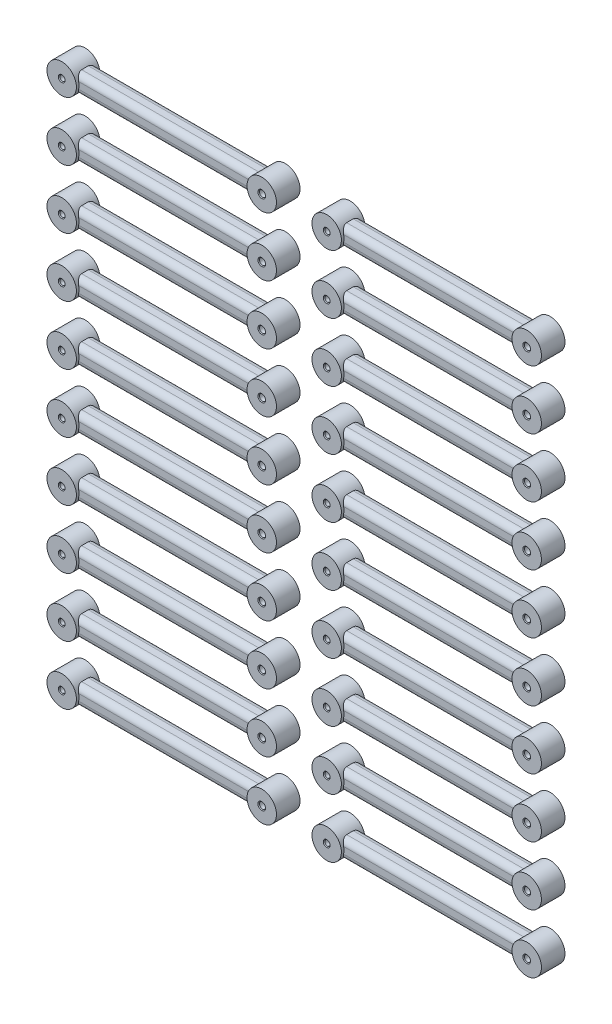
from build123d import *

# Parameters (mm, degrees)
SKETCH_1_R                       = 2
SKETCH_1_R_2                     = 0.36
EXTRUDE_1_DEPTH                  = 1.6
SKETCH_1_R_3                     = 0.42
EXTRUDE_1_2_DEPTH                = 1.6
EXTRUDE_2_REACH                  = 28.306
EXTRUDE_2_END_RADIUS             = 2
SKETCH_2_W                       = 2.5
SKETCH_2_H                       = 2.5
EXTRUDE_2_DIRECTION_2_REACH      = 28.306
EXTRUDE_2_DIRECTION_2_END_RADIUS = 2
CHAMFER_1_SIZE                   = 0.1
FILLET_1_R                       = 0.8
PATTERN_LINEAR_1_COUNT           = 10
PATTERN_LINEAR_1_PITCH           = 8
PATTERN_LINEAR_1_2_COUNT         = 2
PATTERN_LINEAR_1_2_PITCH         = 36


with BuildPart() as part:
    # 草图1 → 凸台-拉伸1 (new, symmetric)
    with BuildSketch(Plane.XY):
        Circle(SKETCH_1_R)
        Circle(SKETCH_1_R_2, mode=Mode.SUBTRACT)
    extrude(amount=EXTRUDE_1_DEPTH, both=True)



with BuildPart() as body_2:
    # 草图1 → Extrude 1 2 (new, symmetric)
    with BuildSketch(Plane.XY):
        with Locations((27.180718048, 0)):
            Circle(SKETCH_1_R)
        with Locations((27.180718048, 0)):
            Circle(SKETCH_1_R_3, mode=Mode.SUBTRACT)
    extrude(amount=EXTRUDE_1_2_DEPTH, both=True)


with BuildPart() as part_1:
    add(part.part)

    add(body_2.part)  # 凸台-拉伸2 merges body 2
    # 凸台-拉伸2: up to this cylinder (the profile starts outside it)
    extrude_2_end = Plane(origin=(27.180718048, 0, 0), z_dir=(0, 0, -1)) * Cylinder(EXTRUDE_2_END_RADIUS, 61.612, mode=Mode.PRIVATE)
    # 草图2 → 凸台-拉伸2 (add, up to the surface)
    with BuildSketch(Plane(origin=(3, 0, 0), x_dir=(0, 0, -1), z_dir=(1, 0, 0)), mode=Mode.PRIVATE) as extrude_2_sk1:
        Rectangle(SKETCH_2_W, SKETCH_2_H)
    extrude_2_tool1 = extrude(extrude_2_sk1.sketch, amount=EXTRUDE_2_REACH, mode=Mode.PRIVATE) - extrude_2_end
    add(extrude_2_tool1.solids().sort_by_distance((3, 0, 0))[0])

    # 凸台-拉伸2 direction 2: up to this cylinder (the profile starts outside it)
    extrude_2_direction_2_end = Plane(origin=(0, 0, 0), z_dir=(0, 0, -1)) * Cylinder(EXTRUDE_2_DIRECTION_2_END_RADIUS, 61.612, mode=Mode.PRIVATE)
    # 草图2 → 凸台-拉伸2 direction 2 (add, up to the surface)
    with BuildSketch(Plane(origin=(3, 0, 0), x_dir=(0, 0, -1), z_dir=(1, 0, 0)), mode=Mode.PRIVATE) as extrude_2_direction_2_sk1:
        Rectangle(SKETCH_2_W, SKETCH_2_H)
    extrude_2_direction_2_tool1 = extrude(extrude_2_direction_2_sk1.sketch, amount=-EXTRUDE_2_DIRECTION_2_REACH, mode=Mode.PRIVATE) - extrude_2_direction_2_end
    add(extrude_2_direction_2_tool1.solids().sort_by_distance((3, 0, 0))[0])

    # 倒角1
    chamfer_1_edges = [part_1.edges().sort_by_distance(p)[0] for p in [
        (26.760718048, 0, 1.6),
        (26.760718048, 0, -1.6),
        (-0.36, 0, 1.6),
        (-0.36, 0, -1.6),
    ]]
    chamfer(chamfer_1_edges, length=CHAMFER_1_SIZE)

    # 圆角1
    fillet_1_edges = [part_1.edges().sort_by_distance(p)[0] for p in [
        (13.590359024, -1.25, 1.25),
        (13.590359024, -1.25, -1.25),
        (13.590359024, 1.25, 1.25),
        (13.590359024, 1.25, -1.25),
    ]]
    fillet(fillet_1_edges, radius=FILLET_1_R)


with BuildPart() as pattern_linear_1_1:
    # 阵列(线性)1: pattern copy
    add(part_1.part.moved(Location(Vector(0, 1, 0) * (1 * PATTERN_LINEAR_1_PITCH))))


with BuildPart() as pattern_linear_1_2:
    # 阵列(线性)1: pattern copy
    add(part_1.part.moved(Location(Vector(0, 1, 0) * (2 * PATTERN_LINEAR_1_PITCH))))


with BuildPart() as pattern_linear_1_3:
    # 阵列(线性)1: pattern copy
    add(part_1.part.moved(Location(Vector(0, 1, 0) * (3 * PATTERN_LINEAR_1_PITCH))))


with BuildPart() as pattern_linear_1_4:
    # 阵列(线性)1: pattern copy
    add(part_1.part.moved(Location(Vector(0, 1, 0) * (4 * PATTERN_LINEAR_1_PITCH))))


with BuildPart() as pattern_linear_1_5:
    # 阵列(线性)1: pattern copy
    add(part_1.part.moved(Location(Vector(0, 1, 0) * (5 * PATTERN_LINEAR_1_PITCH))))


with BuildPart() as pattern_linear_1_6:
    # 阵列(线性)1: pattern copy
    add(part_1.part.moved(Location(Vector(0, 1, 0) * (6 * PATTERN_LINEAR_1_PITCH))))


with BuildPart() as pattern_linear_1_7:
    # 阵列(线性)1: pattern copy
    add(part_1.part.moved(Location(Vector(0, 1, 0) * (7 * PATTERN_LINEAR_1_PITCH))))


with BuildPart() as pattern_linear_1_8:
    # 阵列(线性)1: pattern copy
    add(part_1.part.moved(Location(Vector(0, 1, 0) * (8 * PATTERN_LINEAR_1_PITCH))))


with BuildPart() as pattern_linear_1_9:
    # 阵列(线性)1: pattern copy
    add(part_1.part.moved(Location(Vector(0, 1, 0) * (9 * PATTERN_LINEAR_1_PITCH))))


with BuildPart() as pattern_linear_1_2_1:
    # Pattern Linear 1 2: pattern copy
    add(part_1.part.moved(Location(Vector(1, 0, 0) * (1 * PATTERN_LINEAR_1_2_PITCH))))


with BuildPart() as pattern_linear_1_2_2:
    # Pattern Linear 1 2: pattern copy
    add(pattern_linear_1_1.part.moved(Location(Vector(1, 0, 0) * (1 * PATTERN_LINEAR_1_2_PITCH))))


with BuildPart() as pattern_linear_1_2_3:
    # Pattern Linear 1 2: pattern copy
    add(pattern_linear_1_2.part.moved(Location(Vector(1, 0, 0) * (1 * PATTERN_LINEAR_1_2_PITCH))))


with BuildPart() as pattern_linear_1_2_4:
    # Pattern Linear 1 2: pattern copy
    add(pattern_linear_1_3.part.moved(Location(Vector(1, 0, 0) * (1 * PATTERN_LINEAR_1_2_PITCH))))


with BuildPart() as pattern_linear_1_2_5:
    # Pattern Linear 1 2: pattern copy
    add(pattern_linear_1_4.part.moved(Location(Vector(1, 0, 0) * (1 * PATTERN_LINEAR_1_2_PITCH))))


with BuildPart() as pattern_linear_1_2_6:
    # Pattern Linear 1 2: pattern copy
    add(pattern_linear_1_5.part.moved(Location(Vector(1, 0, 0) * (1 * PATTERN_LINEAR_1_2_PITCH))))


with BuildPart() as pattern_linear_1_2_7:
    # Pattern Linear 1 2: pattern copy
    add(pattern_linear_1_6.part.moved(Location(Vector(1, 0, 0) * (1 * PATTERN_LINEAR_1_2_PITCH))))


with BuildPart() as pattern_linear_1_2_8:
    # Pattern Linear 1 2: pattern copy
    add(pattern_linear_1_7.part.moved(Location(Vector(1, 0, 0) * (1 * PATTERN_LINEAR_1_2_PITCH))))


with BuildPart() as pattern_linear_1_2_9:
    # Pattern Linear 1 2: pattern copy
    add(pattern_linear_1_8.part.moved(Location(Vector(1, 0, 0) * (1 * PATTERN_LINEAR_1_2_PITCH))))


with BuildPart() as pattern_linear_1_2_10:
    # Pattern Linear 1 2: pattern copy
    add(pattern_linear_1_9.part.moved(Location(Vector(1, 0, 0) * (1 * PATTERN_LINEAR_1_2_PITCH))))


solid = Compound([part_1.part, pattern_linear_1_1.part, pattern_linear_1_2.part, pattern_linear_1_3.part, pattern_linear_1_4.part, pattern_linear_1_5.part, pattern_linear_1_6.part, pattern_linear_1_7.part, pattern_linear_1_8.part, pattern_linear_1_9.part, pattern_linear_1_2_1.part, pattern_linear_1_2_2.part, pattern_linear_1_2_3.part, pattern_linear_1_2_4.part, pattern_linear_1_2_5.part, pattern_linear_1_2_6.part, pattern_linear_1_2_7.part, pattern_linear_1_2_8.part, pattern_linear_1_2_9.part, pattern_linear_1_2_10.part])
